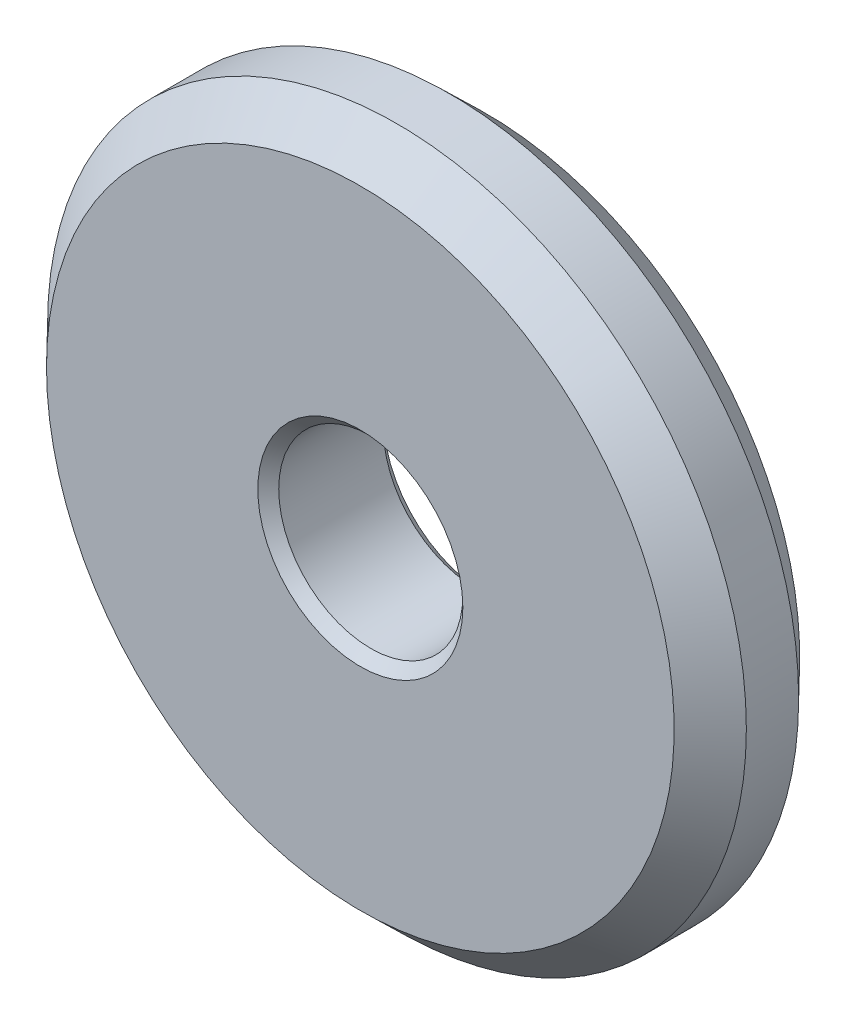
from build123d import *

# Parameters (mm, degrees)
CHAMFER1_SIZE = 0.5


with BuildPart() as part:
    # Sketch1 → Revolve1 (revolve)
    with BuildSketch(Plane(origin=(0, 0, 0), x_dir=(0, 0, -1), z_dir=(1, 0, 0)), mode=Mode.PRIVATE) as revolve1_sk:
        Polygon((0, 4.4), (0, 15), (-1.75, 16.7), (-4.25, 16.7), (-6, 15), (-6, 4.4), align=None)
    revolve(revolve1_sk.sketch.rotate(Axis((0, 0, 0), (0, 0, 1)), 90), axis=Axis((0, 0, 0), (0, 0, 1)))

    # Chamfer1
    chamfer1_edges = [part.edges().sort_by_distance(p)[0] for p in [
        (4.4, 0, 6),
        (4.4, 0, 0),
    ]]
    chamfer(chamfer1_edges, length=CHAMFER1_SIZE)


solid = part.part
